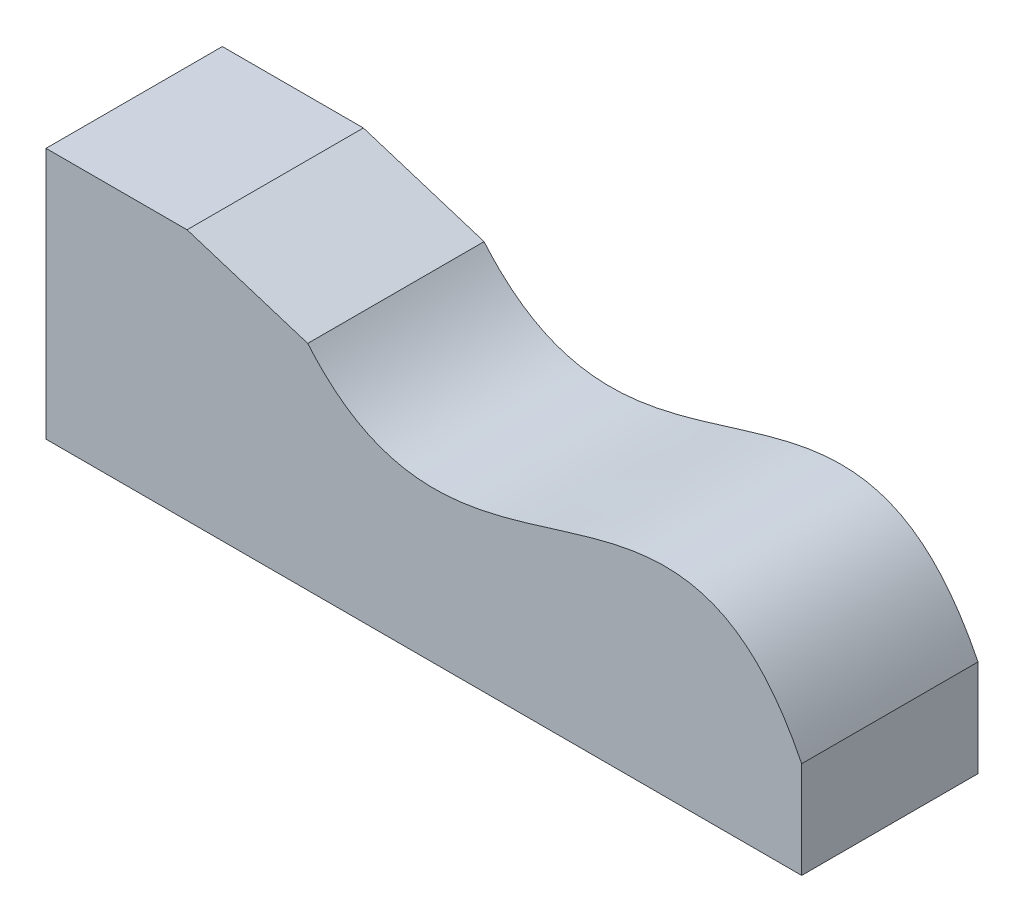
from build123d import *

# Parameters (mm, degrees)
EXTRUDE_1_DEPTH = 35


with BuildPart() as part:
    # 草圖2 → 填料-伸長1 (new body)
    with BuildSketch(Plane.XY):
        with BuildLine():
            Line((0, 0), (0, 50))
            Line((0, 50), (28, 50))
            Line((28, 50), (51.956313103, 42.44328469))
            add(Edge.make_bspline(
                [(51.956313103, 42.44328469), (83.897076516, 4.556034867), (124.627264654, 70.257246507), (150, 19.209377101)],
                knots=[0, 0, 0, 0, 1, 1, 1, 1], degree=3))
            Line((150, 19.209377101), (150, 0))
            Line((150, 0), (0, 0))
        make_face()
    extrude(amount=EXTRUDE_1_DEPTH)


solid = part.part
